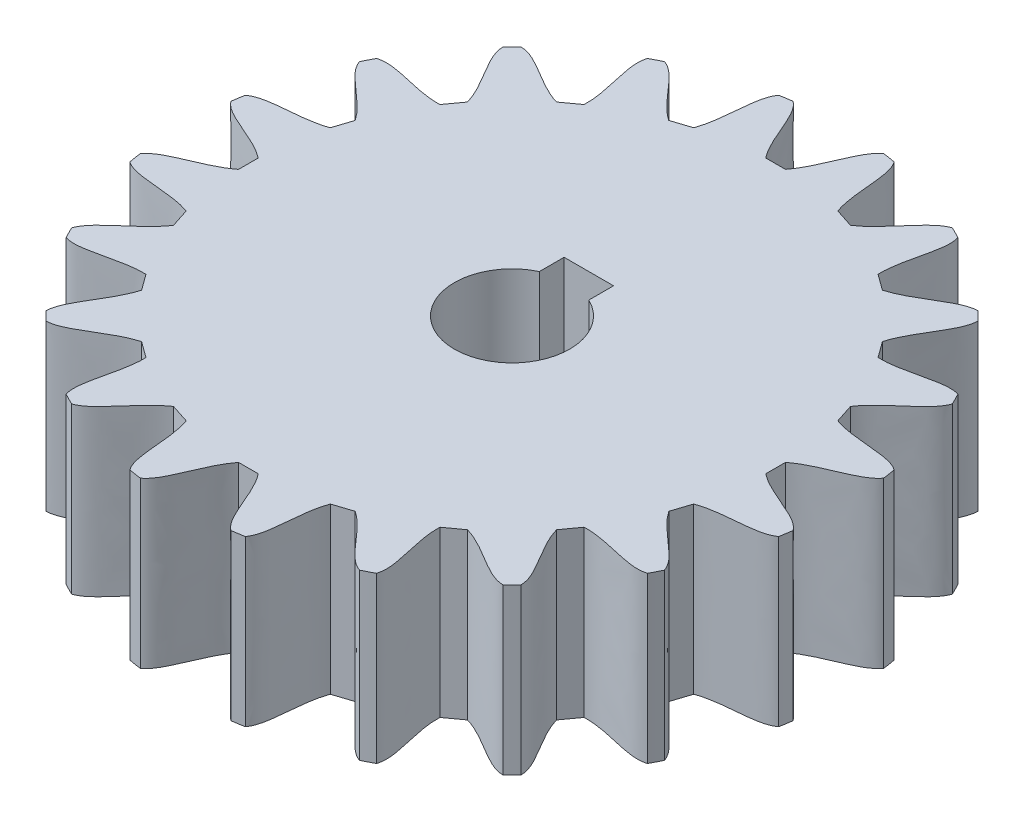
from build123d import *

# Parameters (mm, degrees)
ESQUISSE1_R                  = 20
BOSS_EXTRU_2_DEPTH           = 10
ENL_V_MAT_EXTRU_2_DEPTH      = 100
R_P_TITION_CIRCULAIRE3_COUNT = 20


with BuildPart() as part:
    # Esquisse1 → Boss.-Extru.2 (new body)
    with BuildSketch(Plane(origin=(0, 0, 0), x_dir=(1, 0, 0), z_dir=(0, 1, 0))):
        with Locations(Location((0, 0, 0), (0, 0, 270))):
            Circle(ESQUISSE1_R)
        with BuildLine():
            Line((-1.5, 3.16227766), (-1.5, 4.66227766))
            Line((-1.5, 4.66227766), (1.5, 4.66227766))
            Line((1.5, 4.66227766), (1.5, 3.16227766))
            ThreePointArc((1.5, 3.16227766), (0, -3.5), (-1.5, 3.16227766))
        make_face(mode=Mode.SUBTRACT)
    extrude(amount=BOSS_EXTRU_2_DEPTH)

    # Esquisse3 → Enlèv. mat.-Extru.2 (cut)
    with BuildSketch(Plane(origin=(0, 10, 0), x_dir=(1, 0, 0), z_dir=(0, 1, 0))):
        with BuildLine():
            Line((-0.6, 16), (0.6, 16))
            add(Edge.make_bspline(
                [(0.6, 16), (1.625183433, 17.31778232), (1.932590325, 19.478169646), (2.948740885, 19.921478875)],
                knots=[0, 0, 0, 0, 1, 1, 1, 1], degree=3))
            ThreePointArc((2.948740885, 19.921478875), (0, 22.949786157), (-2.948740885, 19.921478875))
            add(Edge.make_bspline(
                [(-0.6, 16), (-1.625183433, 17.31778232), (-1.932590325, 19.478169646), (-2.948740885, 19.921478875)],
                knots=[0, 0, 0, 0, 1, 1, 1, 1], degree=3))
        make_face()
    enl_v_mat_extru_2 = extrude(amount=-ENL_V_MAT_EXTRU_2_DEPTH, mode=Mode.SUBTRACT)

    # Répétition circulaire3: Enlèv. mat.-Extru.2 ×20 about axis
    r_p_tition_circulaire3_axis = Axis((0, 10, 0), (0, 1, 0))
    for i in range(1, R_P_TITION_CIRCULAIRE3_COUNT):
        add(enl_v_mat_extru_2.rotate(r_p_tition_circulaire3_axis, i * 360 / R_P_TITION_CIRCULAIRE3_COUNT), mode=Mode.SUBTRACT)


solid = part.part
